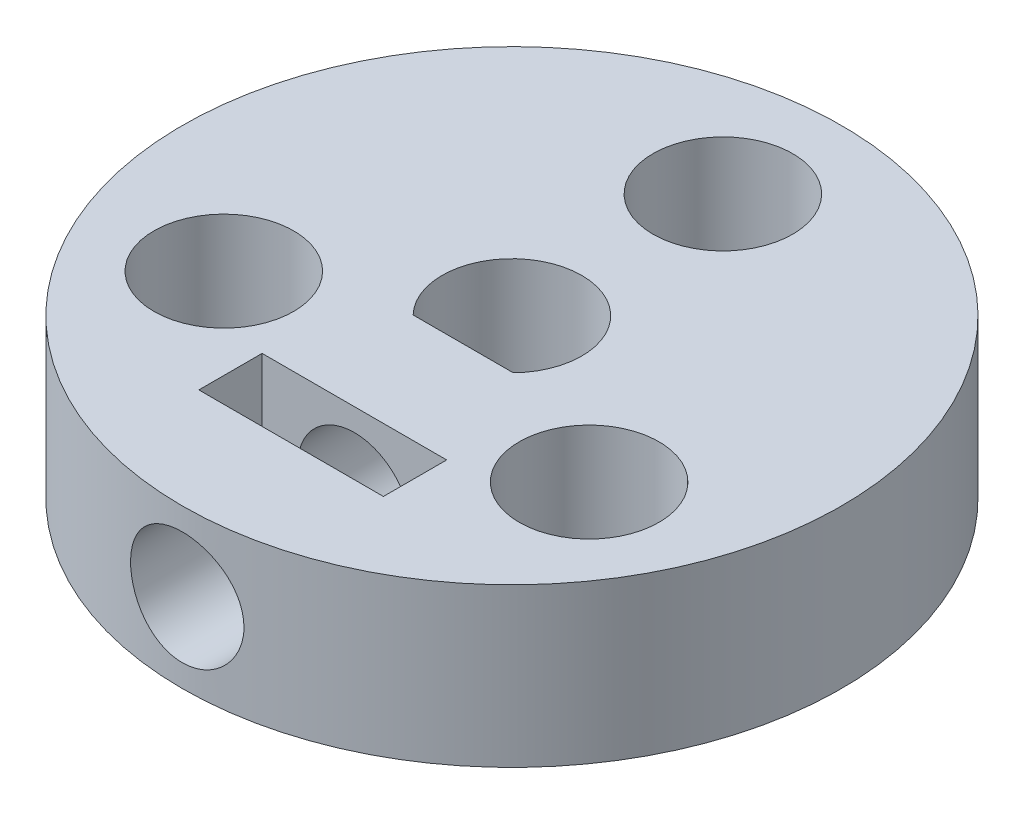
from build123d import *

# Parameters (mm, degrees)
SKETCH1_R               = 12.5
BOSS_EXTRUDE1_DEPTH     = 6
CUT_EXTRUDE1_REACH      = 20.668
CUT_EXTRUDE2_REACH      = 20.668
SKETCH3_W               = 7
SKETCH3_H               = 2.4
CUT_EXTRUDE3_DEPTH      = 1
CUT_EXTRUDE3_DEPTH_BACK = 20.954260197
SKETCH4_R               = 2.15
SKETCH5_R               = 2.65
CUT_EXTRUDE4_DEPTH      = 19.668154869


with BuildPart() as part:
    # Sketch1 → Boss-Extrude1 (new body)
    with BuildSketch(Plane(origin=(0, 0, 0), x_dir=(1, 0, 0), z_dir=(0, 1, 0))):
        Circle(SKETCH1_R)
    extrude(amount=BOSS_EXTRUDE1_DEPTH)

    # Sketch2 → Cut-Extrude1 (cut, up to next)
    with BuildSketch(Plane(origin=(0, 6, 0), x_dir=(1, 0, 0), z_dir=(0, 1, 0)), mode=Mode.PRIVATE) as cut_extrude1_sk1:
        with BuildLine():
            Line((-1.897366596, -1.85), (1.897366596, -1.85))
            ThreePointArc((1.897366596, -1.85), (0, 2.65), (-1.897366596, -1.85))
        make_face()
    cut_extrude1_tool1 = extrude(cut_extrude1_sk1.sketch, amount=-CUT_EXTRUDE1_REACH, mode=Mode.PRIVATE) & part.part
    add(cut_extrude1_tool1.solids().sort_by_distance((0, 6, -0.228052))[0], mode=Mode.SUBTRACT)

    # Sketch3 → Cut-Extrude2 (cut, up to next)
    with BuildSketch(Plane(origin=(0, 6, 0), x_dir=(1, 0, 0), z_dir=(0, 1, 0)), mode=Mode.PRIVATE) as cut_extrude2_sk1:
        with Locations((0, -7.175)):
            Rectangle(SKETCH3_W, SKETCH3_H)
    cut_extrude2_tool1 = extrude(cut_extrude2_sk1.sketch, amount=-CUT_EXTRUDE2_REACH, mode=Mode.PRIVATE) & part.part
    add(cut_extrude2_tool1.solids().sort_by_distance((0, 6, 7.175))[0], mode=Mode.SUBTRACT)

    # Sketch4 → Cut-Extrude3 (cut, two sides: drawn at the far end of the back side and taken through both)
    with BuildSketch(Plane(origin=(0, 0, 1.85), x_dir=(-1, 0, 0), z_dir=(0, 0, -1)).offset(-CUT_EXTRUDE3_DEPTH_BACK)):
        with Locations((0, 3)):
            Circle(SKETCH4_R)
    extrude(amount=CUT_EXTRUDE3_DEPTH + CUT_EXTRUDE3_DEPTH_BACK, mode=Mode.SUBTRACT)

    # Sketch5 → Cut-Extrude4 (cut, through all)
    with BuildSketch(Plane(origin=(0, 6, 0), x_dir=(1, 0, 0), z_dir=(0, 1, 0))):
        with Locations((0, 8)):
            Circle(SKETCH5_R)
        with Locations((6.92820323, -4)):
            Circle(SKETCH5_R)
        with Locations((-6.92820323, -4)):
            Circle(SKETCH5_R)
    extrude(amount=-CUT_EXTRUDE4_DEPTH, mode=Mode.SUBTRACT)


solid = part.part
